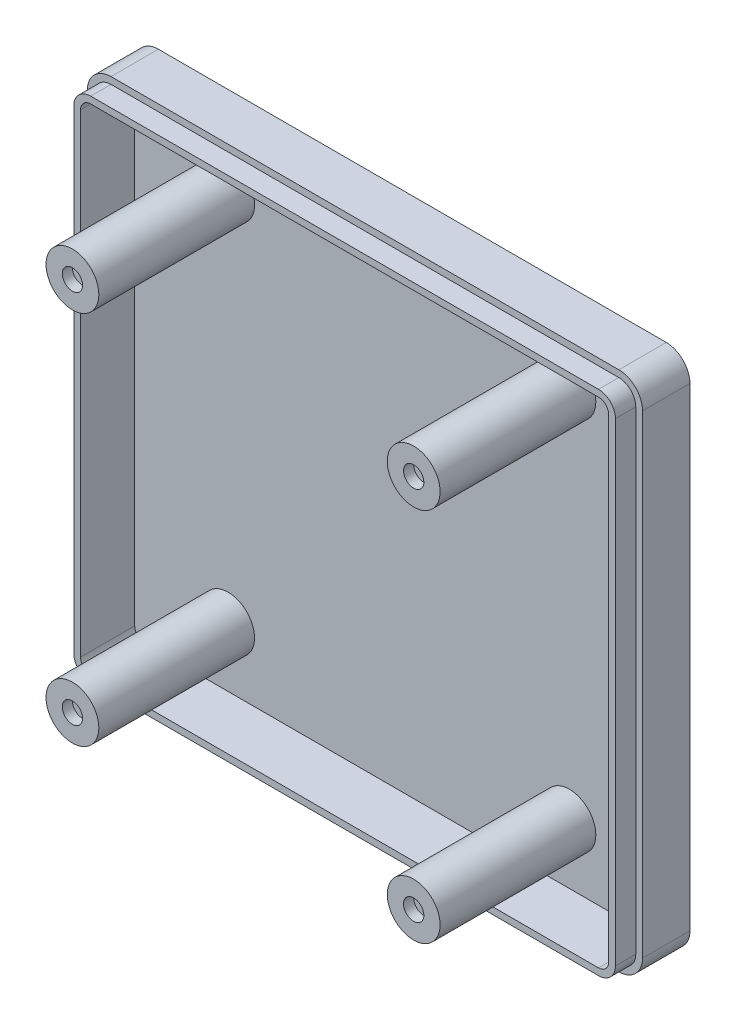
from build123d import *

# Parameters (mm, degrees)
EXTRU_MINCE1_DEPTH      = 10
BOSS_EXTRU_1_DEPTH      = 2
ESQUISSE2_OUTSIDE_W     = 106.586
ESQUISSE2_OUTSIDE_H     = 101.586
ENL_V_MAT_EXTRU_1_DEPTH = 3
ESQUISSE3_R             = 3.9
BOSS_EXTRU_2_DEPTH      = 23
ESQUISSE9_R             = 1.5
ENL_V_MAT_EXTRU_2_DEPTH = 1.5
ESQUISSE12_R            = 1.5
ENL_V_MAT_EXTRU_3_DEPTH = 21


with BuildPart() as part:
    # Esquisse1 → Extru.-Mince1 (new body)
    with BuildSketch(Plane.XY):
        with BuildLine():
            Line((37.5, -38.5), (-37.5, -38.5))
            ThreePointArc((-37.5, -38.5), (-39.974873734, -37.474873734), (-41, -35))
            Line((-41, -35), (-41, 35))
            ThreePointArc((-41, 35), (-39.974873734, 37.474873734), (-37.5, 38.5))
            Line((-37.5, 38.5), (37.5, 38.5))
            ThreePointArc((37.5, 38.5), (39.974873734, 37.474873734), (41, 35))
            Line((41, 35), (41, -35))
            ThreePointArc((41, -35), (39.974873734, -37.474873734), (37.5, -38.5))
        make_face()
        with BuildLine():
            Line((37.5, -36.5), (-37.5, -36.5))
            ThreePointArc((-37.5, -36.5), (-38.560660172, -36.060660172), (-39, -35))
            Line((-39, -35), (-39, 35))
            ThreePointArc((-39, 35), (-38.560660172, 36.060660172), (-37.5, 36.5))
            Line((-37.5, 36.5), (37.5, 36.5))
            ThreePointArc((37.5, 36.5), (38.560660172, 36.060660172), (39, 35))
            Line((39, 35), (39, -35))
            ThreePointArc((39, -35), (38.560660172, -36.060660172), (37.5, -36.5))
        make_face(mode=Mode.SUBTRACT)
    extrude(amount=EXTRU_MINCE1_DEPTH)

    # Esquisse1<2> → Boss.-Extru.1 (add)
    with BuildSketch(Plane.XY):
        with BuildLine():
            Line((-37.5, 37.5), (37.5, 37.5))
            ThreePointArc((37.5, 37.5), (39.267766953, 36.767766953), (40, 35))
            Line((40, 35), (40, -35))
            ThreePointArc((40, -35), (39.267766953, -36.767766953), (37.5, -37.5))
            Line((37.5, -37.5), (-37.5, -37.5))
            ThreePointArc((-37.5, -37.5), (-39.267766953, -36.767766953), (-40, -35))
            Line((-40, -35), (-40, 35))
            ThreePointArc((-40, 35), (-39.267766953, 36.767766953), (-37.5, 37.5))
        make_face()
    extrude(amount=BOSS_EXTRU_1_DEPTH)

    # Esquisse2 outside → Enlèv. mat.-Extru.1 (cut)
    with BuildSketch(Plane.XY.offset(10)):
        Rectangle(ESQUISSE2_OUTSIDE_W, ESQUISSE2_OUTSIDE_H)
        with BuildLine():
            Line((-37.5, 37.5), (37.5, 37.5))
            ThreePointArc((37.5, 37.5), (39.267766953, 36.767766953), (40, 35))
            Line((40, 35), (40, -35))
            ThreePointArc((40, -35), (39.267766953, -36.767766953), (37.5, -37.5))
            Line((37.5, -37.5), (-37.5, -37.5))
            ThreePointArc((-37.5, -37.5), (-39.267766953, -36.767766953), (-40, -35))
            Line((-40, -35), (-40, 35))
            ThreePointArc((-40, 35), (-39.267766953, 36.767766953), (-37.5, 37.5))
        make_face(mode=Mode.SUBTRACT)
    extrude(amount=-ENL_V_MAT_EXTRU_1_DEPTH, mode=Mode.SUBTRACT)

    # Esquisse3 → Boss.-Extru.2 (add)
    with BuildSketch(Plane.XY.offset(2)):
        with Locations((-25.2, 27.7)):
            Circle(ESQUISSE3_R)
        with Locations((25.2, 27.7)):
            Circle(ESQUISSE3_R)
        with Locations((-25.2, -27.7)):
            Circle(ESQUISSE3_R)
        with Locations((25.2, -27.7)):
            Circle(ESQUISSE3_R)
    extrude(amount=BOSS_EXTRU_2_DEPTH)

    # Esquisse9 → Enlèv. mat.-Extru.2 (cut)
    with BuildSketch(Plane.XY.offset(25)):
        with Locations((-25.2, 27.7)):
            Circle(ESQUISSE9_R)
        with Locations((25.2, 27.7)):
            Circle(ESQUISSE9_R)
        with Locations((-25.2, -27.7)):
            Circle(ESQUISSE9_R)
        with Locations((25.2, -27.7)):
            Circle(ESQUISSE9_R)
    extrude(amount=-ENL_V_MAT_EXTRU_2_DEPTH, mode=Mode.SUBTRACT)

    # Esquisse12 → Enlèv. mat.-Extru.3 (cut)
    with BuildSketch(Plane(origin=(0, 0, 0), x_dir=(-1, 0, 0), z_dir=(0, 0, -1))):
        with Locations((24.9, 27.4)):
            Circle(ESQUISSE12_R)
        with Locations((-24.9, 27.4)):
            Circle(ESQUISSE12_R)
        with Locations((-24.9, -27.4)):
            Circle(ESQUISSE12_R)
        with Locations((24.9, -27.4)):
            Circle(ESQUISSE12_R)
    extrude(amount=-ENL_V_MAT_EXTRU_3_DEPTH, mode=Mode.SUBTRACT)


solid = part.part
